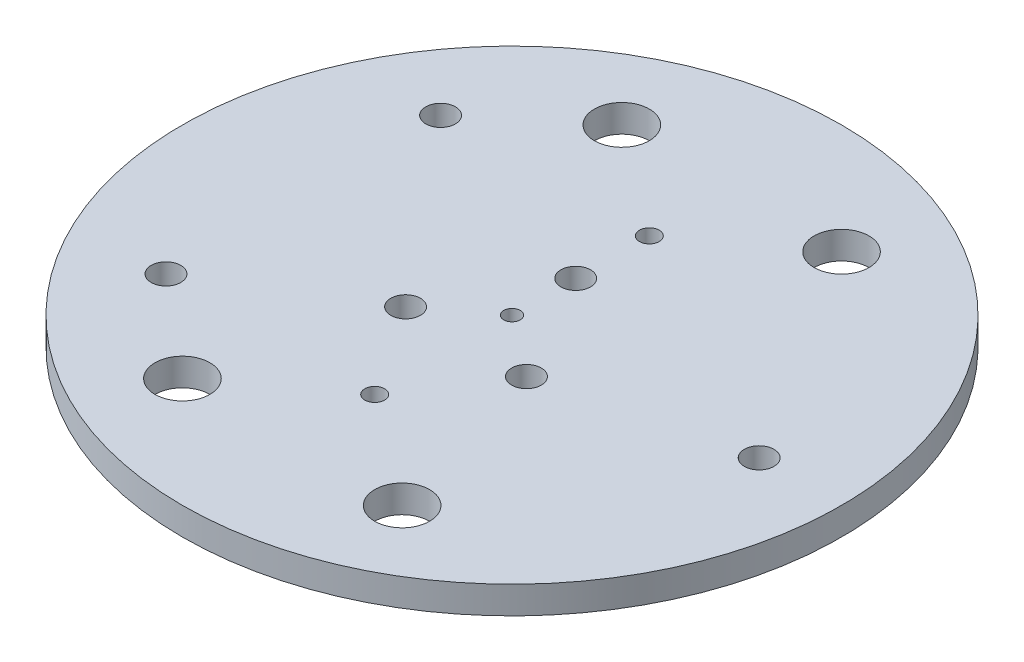
from build123d import *

# Parameters (mm, degrees)
SKETCH1_R           = 76.2
BOSS_EXTRUDE1_DEPTH = 6.35
SKETCH2_R           = 1.905
CUT_EXTRUDE1_DEPTH  = 108.95
SKETCH3_R           = 3.429
CUT_EXTRUDE2_DEPTH  = 108.95
SKETCH4_R           = 6.35
CUT_EXTRUDE3_DEPTH  = 108.95
SKETCH5_R           = 6.35
CUT_EXTRUDE4_DEPTH  = 108.95
SKETCH7_R           = 2.54
CUT_EXTRUDE6_DEPTH  = 108.95
SKETCH8_R           = 3.429
CUT_EXTRUDE7_DEPTH  = 108.95
SKETCH9_R           = 3.429
CUT_EXTRUDE8_DEPTH  = 108.95
SKETCH10_R          = 2.54
BOSS_EXTRUDE2_DEPTH = 6.35
SKETCH11_R          = 2.286
CUT_EXTRUDE9_DEPTH  = 108.95


with BuildPart() as part:
    # Sketch1 → Boss-Extrude1 (new body)
    with BuildSketch(Plane(origin=(0, 0, 0), x_dir=(1, 0, 0), z_dir=(0, 1, 0))):
        with Locations(Location((0, 0, 0), (0, 0, 270))):
            Circle(SKETCH1_R)
    extrude(amount=BOSS_EXTRUDE1_DEPTH)

    # Sketch2 → Cut-Extrude1 (cut, through all)
    with BuildSketch(Plane(origin=(0, 6.35, 0), x_dir=(1, 0, 0), z_dir=(0, 1, 0))):
        with Locations(Location((0, 0, 0), (0, 0, 270))):
            Circle(SKETCH2_R)
    extrude(amount=-CUT_EXTRUDE1_DEPTH, mode=Mode.SUBTRACT)

    # Sketch3 → Cut-Extrude2 (cut, through all)
    with BuildSketch(Plane(origin=(0, 6.35, 0), x_dir=(1, 0, 0), z_dir=(0, 1, 0))):
        with Locations(Location((0, 14.732, 0), (0, 0, 270))):
            Circle(SKETCH3_R)
        with Locations(Location((-13.97, -10.631143259, 0), (0, 0, 270))):
            Circle(SKETCH3_R)
        with Locations(Location((13.97, -10.631143259, 0), (0, 0, 270))):
            Circle(SKETCH3_R)
    extrude(amount=-CUT_EXTRUDE2_DEPTH, mode=Mode.SUBTRACT)

    # Sketch4 → Cut-Extrude3 (cut, through all)
    with BuildSketch(Plane(origin=(0, 6.35, 0), x_dir=(1, 0, 0), z_dir=(0, 1, 0))):
        with Locations(Location((-25.4, -50.8, 0), (0, 0, 270))):
            Circle(SKETCH4_R)
        with Locations(Location((25.4, -50.8, 0), (0, 0, 270))):
            Circle(SKETCH4_R)
    extrude(amount=-CUT_EXTRUDE3_DEPTH, mode=Mode.SUBTRACT)

    # Sketch5 → Cut-Extrude4 (cut, through all)
    with BuildSketch(Plane(origin=(0, 6.35, 0), x_dir=(1, 0, 0), z_dir=(0, 1, 0))):
        with Locations(Location((-25.4, 50.8, 0), (0, 0, 270))):
            Circle(SKETCH5_R)
        with Locations(Location((25.4, 50.8, 0), (0, 0, 270))):
            Circle(SKETCH5_R)
    extrude(amount=-CUT_EXTRUDE4_DEPTH, mode=Mode.SUBTRACT)

    # Sketch7 → Cut-Extrude6 (cut, through all)
    with BuildSketch(Plane(origin=(0, 6.35, 0), x_dir=(1, 0, 0), z_dir=(0, 1, 0))):
        with Locations(Location((0, 46.99, 0), (0, 0, 270))):
            Circle(SKETCH7_R)
        with Locations(Location((0, -46.99, 0), (0, 0, 270))):
            Circle(SKETCH7_R)
    extrude(amount=-CUT_EXTRUDE6_DEPTH, mode=Mode.SUBTRACT)

    # Sketch8 → Cut-Extrude7 (cut, through all)
    with BuildSketch(Plane(origin=(0, 6.35, 0), x_dir=(1, 0, 0), z_dir=(0, 1, 0))):
        with Locations(Location((57.15, 0, 0), (0, 0, 270))):
            Circle(SKETCH8_R)
    extrude(amount=-CUT_EXTRUDE7_DEPTH, mode=Mode.SUBTRACT)

    # Sketch9 → Cut-Extrude8 (cut, through all)
    with BuildSketch(Plane(origin=(0, 6.35, 0), x_dir=(1, 0, 0), z_dir=(0, 1, 0))):
        with Locations(Location((-48.26, -31.75, 0), (0, 0, 270))):
            Circle(SKETCH9_R)
        with Locations(Location((-48.26, 31.75, 0), (0, 0, 270))):
            Circle(SKETCH9_R)
    extrude(amount=-CUT_EXTRUDE8_DEPTH, mode=Mode.SUBTRACT)

    # Sketch10 → Boss-Extrude2 (add)
    with BuildSketch(Plane(origin=(0, 6.35, 0), x_dir=(1, 0, 0), z_dir=(0, 1, 0))):
        with Locations((0, 46.99)):
            Circle(SKETCH10_R)
        with Locations((0, -46.99)):
            Circle(SKETCH10_R)
    extrude(amount=-BOSS_EXTRUDE2_DEPTH)

    # Sketch11 → Cut-Extrude9 (cut, through all)
    with BuildSketch(Plane(origin=(0, 6.35, 0), x_dir=(1, 0, 0), z_dir=(0, 1, 0))):
        with Locations(Location((0, -31.75, 0), (0, 0, 270))):
            Circle(SKETCH11_R)
        with Locations(Location((0, 31.75, 0), (0, 0, 270))):
            Circle(SKETCH11_R)
    extrude(amount=-CUT_EXTRUDE9_DEPTH, mode=Mode.SUBTRACT)


solid = part.part
